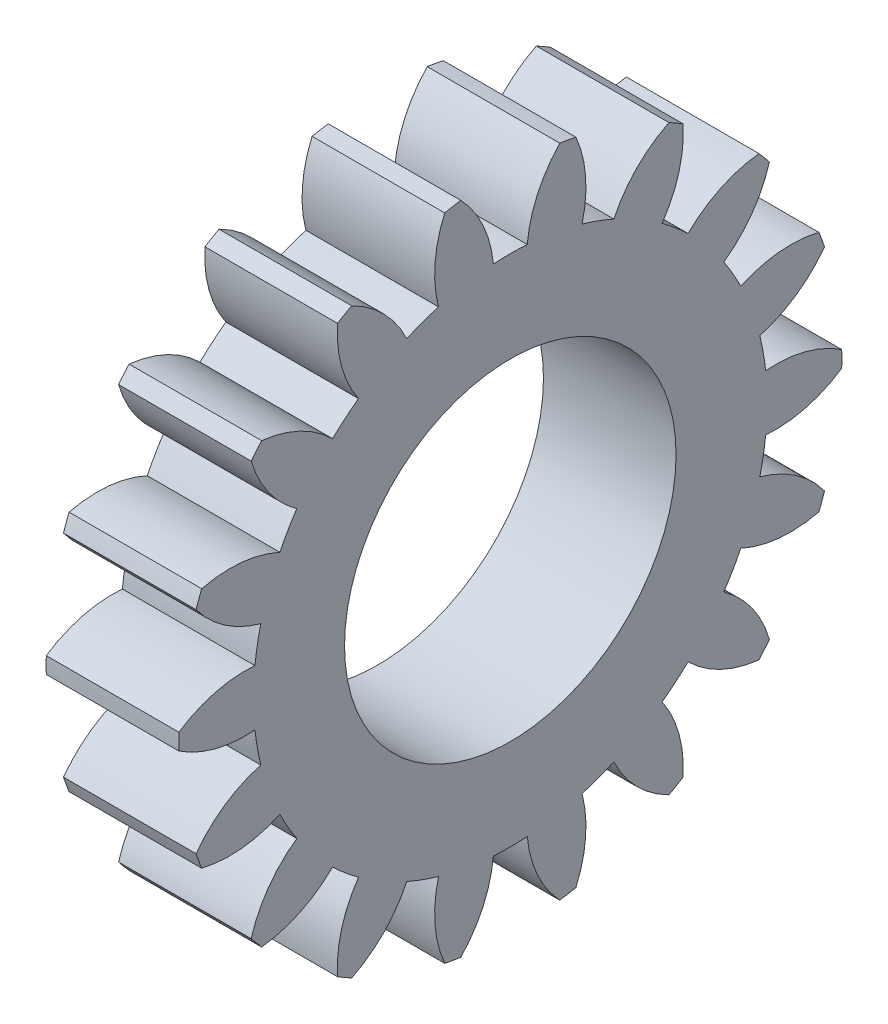
from build123d import *

# Parameters (mm, degrees)
BASPROSKE_W     = 4
BASPROSKE_H     = 10
TOOTHCUT_DEPTH  = 15.696938457
TEETHCUTS_COUNT = 18
TEETHCUTS_ANGLE = 340
BORSKE_R        = 5
BORE_DEPTH      = 50.0000508


with BuildPart() as part:
    # BasProSke → Base-Revolve (revolve)
    with BuildSketch(Plane(origin=(0, 0, 0), x_dir=(1, 0, 0), z_dir=(0, 1, 0)), mode=Mode.PRIVATE) as base_revolve_sk:
        with Locations((2, 5)):
            Rectangle(BASPROSKE_W, BASPROSKE_H)
    revolve(base_revolve_sk.sketch.rotate(Axis((-10, 0, 0), (1, 0, 0)), 180), axis=Axis((-10, 0, 0), (1, 0, 0)))

    # TooCutSke → ToothCut (cut, through all)
    with BuildSketch(Plane(origin=(0, 0, 0), x_dir=(0, 0, -1), z_dir=(1, 0, 0))):
        with BuildLine():
            ThreePointArc((0.510641536, 7.732156635), (0, 7.749), (-0.510641536, 7.732156635))
            ThreePointArc((-0.510641536, 7.732156635), (-0.82619259, 8.907320741), (-1.515208602, 9.910236529))
            ThreePointArc((-1.515208602, 9.910236529), (0, 10.0254), (1.515208602, 9.910236529))
            ThreePointArc((1.515208602, 9.910236529), (0.82619259, 8.907320741), (0.510641536, 7.732156635))
        make_face()
    toothcut = extrude(amount=TOOTHCUT_DEPTH, mode=Mode.SUBTRACT)

    # TeethCuts: ToothCut ×18 about axis
    teethcuts_axis = Axis((-10, 0, 0), (1, 0, 0))
    for i in range(1, TEETHCUTS_COUNT):
        add(toothcut.rotate(teethcuts_axis, i * TEETHCUTS_ANGLE / (TEETHCUTS_COUNT - 1)), mode=Mode.SUBTRACT)

    # BorSke → Bore (cut, symmetric)
    with BuildSketch(Plane(origin=(0, 0, 0), x_dir=(0, 0, -1), z_dir=(1, 0, 0))):
        with Locations(Location((0, 0, 0), (0, 0, 180))):
            Circle(BORSKE_R)
    extrude(amount=BORE_DEPTH, both=True, mode=Mode.SUBTRACT)


solid = part.part
